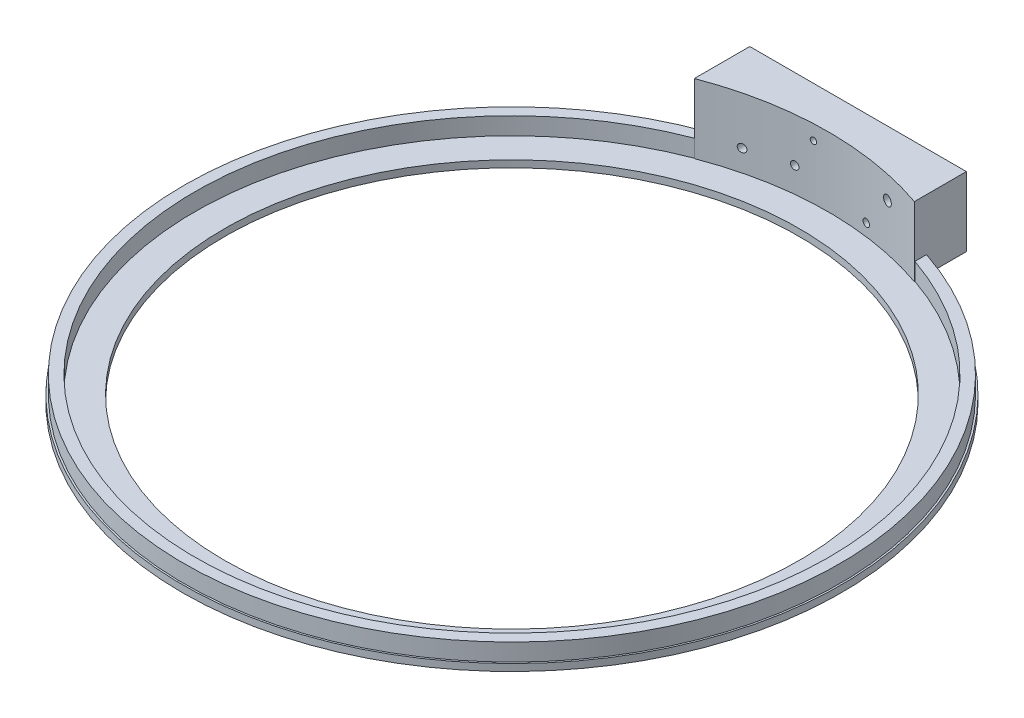
from build123d import *

# Parameters (mm, degrees)
SKETCH1_R           = 95
SKETCH1_R_2         = 82.849042413
BOSS_EXTRUDE1_DEPTH = 2
SKETCH3_R           = 94.494442109
SKETCH3_R_2         = 91.333084699
BOSS_EXTRUDE2_DEPTH = 5
SKETCH4_W           = 62.439949526
SKETCH4_H           = 16.999481769
BOSS_EXTRUDE3_DEPTH = 20
SKETCH5_R           = 91.187715278
CUT_EXTRUDE1_DEPTH  = 20
SKETCH6_R           = 1.133326697
SKETCH6_R_2         = 0.88409454
SKETCH6_R_3         = 1.06382022
SKETCH6_R_4         = 1.11678576
SKETCH6_R_5         = 1.422635849
CUT_EXTRUDE2_DEPTH  = 25


with BuildPart() as part:
    # Sketch1 → Boss-Extrude1 (new body)
    with BuildSketch(Plane(origin=(0, 0, 0), x_dir=(1, 0, 0), z_dir=(0, 1, 0))):
        with Locations(Location((0, 0, 0), (0, 0, 270))):
            Circle(SKETCH1_R)
        with Locations(Location((0, 0, 0), (0, 0, 270))):
            Circle(SKETCH1_R_2, mode=Mode.SUBTRACT)
    extrude(amount=BOSS_EXTRUDE1_DEPTH)

    # Sketch3 → Boss-Extrude2 (add)
    with BuildSketch(Plane(origin=(0, 2, 0), x_dir=(1, 0, 0), z_dir=(0, 1, 0))):
        with Locations(Location((0, 0, 0), (0, 0, 270))):
            Circle(SKETCH3_R)
        with Locations(Location((0, 0, 0), (0, 0, 270))):
            Circle(SKETCH3_R_2, mode=Mode.SUBTRACT)
    extrude(amount=BOSS_EXTRUDE2_DEPTH)

    # Sketch4 → Boss-Extrude3 (add)
    with BuildSketch(Plane(origin=(0, 2, 0), x_dir=(1, 0, 0), z_dir=(0, 1, 0))):
        with Locations((-1.369214929, 92.645399109)):
            Rectangle(SKETCH4_W, SKETCH4_H)
    extrude(amount=BOSS_EXTRUDE3_DEPTH)

    # Sketch5 → Cut-Extrude1 (cut)
    with BuildSketch(Plane(origin=(0, 2, 0), x_dir=(1, 0, 0), z_dir=(0, 1, 0))):
        Circle(SKETCH5_R)
    extrude(amount=CUT_EXTRUDE1_DEPTH, mode=Mode.SUBTRACT)

    # Sketch6 → Cut-Extrude2 (cut)
    with BuildSketch(Plane(origin=(0, 0, -101.145139993), x_dir=(-1, 0, 0), z_dir=(0, 0, -1))):
        with Locations((22.112365303, 8.203766253)):
            Circle(SKETCH6_R)
        with Locations((4.179872068, 17.724091109)):
            Circle(SKETCH6_R_2)
        with Locations((-11.723213238, 5.51353779)):
            Circle(SKETCH6_R_3)
        with Locations((9.192330575, 9.220604642)):
            Circle(SKETCH6_R_4)
        with Locations((-19.090082193, 15.373412308)):
            Circle(SKETCH6_R_5)
    extrude(amount=-CUT_EXTRUDE2_DEPTH, mode=Mode.SUBTRACT)


solid = part.part
